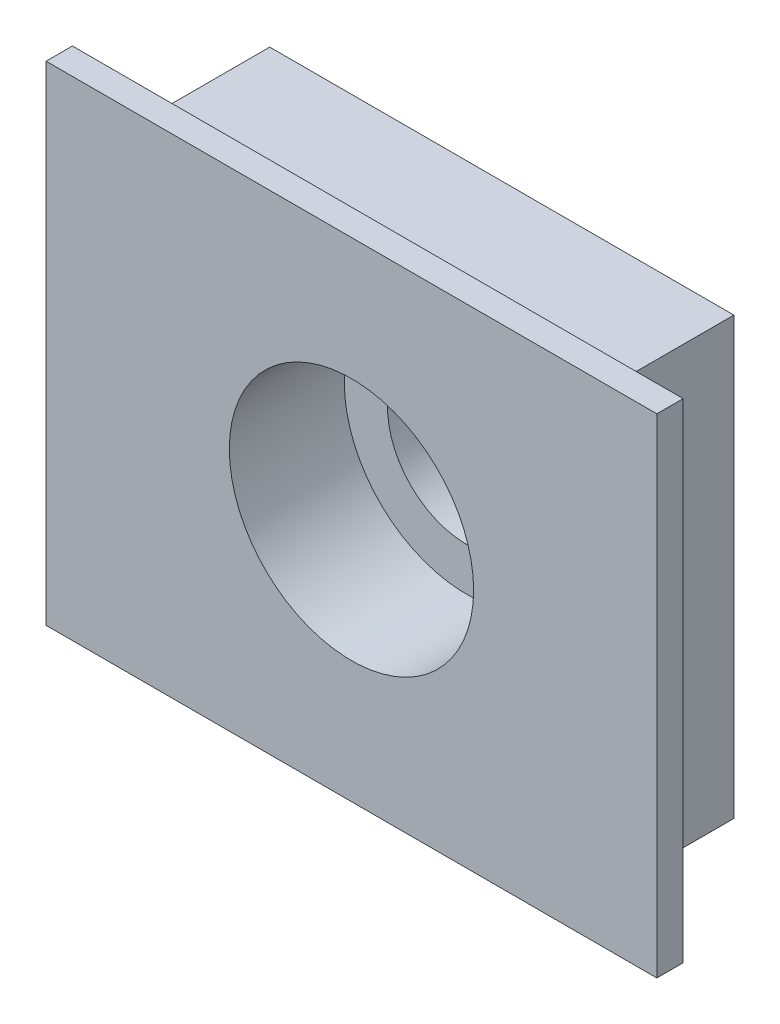
from build123d import *

# Parameters (mm, degrees)
SKETCH1_W           = 325
SKETCH1_H           = 260
BOSS_EXTRUDE1_DEPTH = 80
SKETCH2_R           = 65
CUT_EXTRUDE1_DEPTH  = 61.2
SKETCH3_R           = 42
CUT_EXTRUDE2_DEPTH  = 424.821896556
SKETCH4_W           = 325
SKETCH4_H           = 260
SKETCH4_W_2         = 247
SKETCH4_H_2         = 232
CUT_EXTRUDE3_DEPTH  = 66


with BuildPart() as part:
    # Sketch1 → Boss-Extrude1 (new body)
    with BuildSketch(Plane.XY):
        with Locations((162.5, 130)):
            Rectangle(SKETCH1_W, SKETCH1_H)
    extrude(amount=-BOSS_EXTRUDE1_DEPTH)

    # Sketch2 → Cut-Extrude1 (cut)
    with BuildSketch(Plane.XY):
        with Locations((162.5, 130)):
            Circle(SKETCH2_R)
    extrude(amount=-CUT_EXTRUDE1_DEPTH, mode=Mode.SUBTRACT)

    # Sketch3 → Cut-Extrude2 (cut, through all)
    with BuildSketch(Plane.XY):
        with Locations((162.5, 130)):
            Circle(SKETCH3_R)
    extrude(amount=-CUT_EXTRUDE2_DEPTH, mode=Mode.SUBTRACT)

    # Sketch4 → Cut-Extrude3 (cut)
    with BuildSketch(Plane(origin=(0, 0, -80), x_dir=(-1, 0, 0), z_dir=(0, 0, -1))):
        with Locations((-162.5, 130)):
            Rectangle(SKETCH4_W, SKETCH4_H)
        with Locations((-162.5, 130)):
            Rectangle(SKETCH4_W_2, SKETCH4_H_2, mode=Mode.SUBTRACT)
    extrude(amount=-CUT_EXTRUDE3_DEPTH, mode=Mode.SUBTRACT)


solid = part.part
